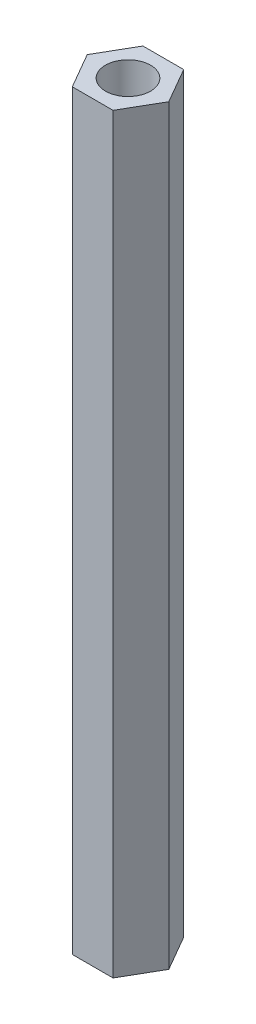
from build123d import *

# Parameters (mm, degrees)
SKETCH_1_R      = 1.5
EXTRUDE_1_DEPTH = 50


with BuildPart() as part:
    # 草图1 → 凸台-拉伸1 (new body)
    with BuildSketch(Plane(origin=(0, 0, 0), x_dir=(1, 0, 0), z_dir=(0, 1, 0))):
        Polygon((2.713546265, 0), (1.356773133, 2.35), (-1.356773133, 2.35), (-2.713546265, 0), (-1.356773133, -2.35), (1.356773133, -2.35), align=None)
        with Locations(Location((0, 0, 0), (0, 0, 270))):
            Circle(SKETCH_1_R, mode=Mode.SUBTRACT)
    extrude(amount=EXTRUDE_1_DEPTH)


solid = part.part
